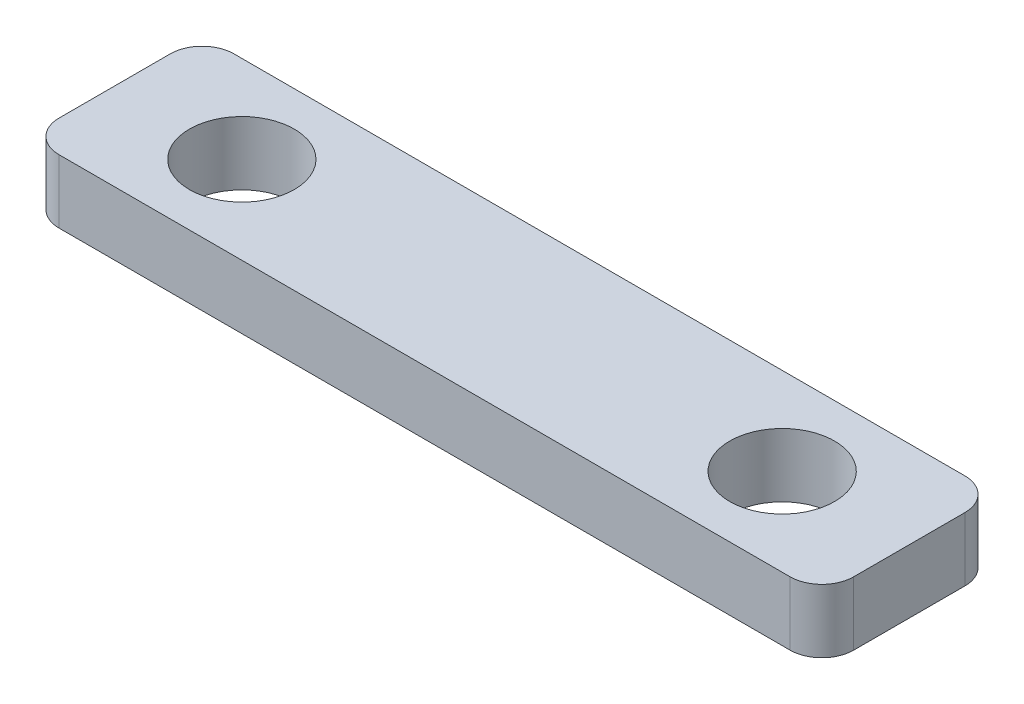
from build123d import *

# Parameters (mm, degrees)
SKETCH1_W           = 25
SKETCH1_H           = 5.5
SKETCH1_R           = 1.65
BOSS_EXTRUDE1_DEPTH = 2
FILLET1_R           = 1


with BuildPart() as part:
    # Sketch1 → Boss-Extrude1 (new body)
    with BuildSketch(Plane(origin=(0, 0, 0), x_dir=(1, 0, 0), z_dir=(0, 1, 0))):
        with Locations((12.5, 2.75)):
            Rectangle(SKETCH1_W, SKETCH1_H)
        with Locations(Location((4, 2.75, 0), (0, 0, 270))):
            Circle(SKETCH1_R, mode=Mode.SUBTRACT)
        with Locations(Location((21, 2.75, 0), (0, 0, 270))):
            Circle(SKETCH1_R, mode=Mode.SUBTRACT)
    extrude(amount=BOSS_EXTRUDE1_DEPTH)

    # Fillet1
    fillet1_edges = [part.edges().sort_by_distance(p)[0] for p in [
        (0, 1, -5.5),
        (25, 1, -5.5),
        (25, 1, 0),
        (0, 1, 0),
    ]]
    fillet(fillet1_edges, radius=FILLET1_R)


solid = part.part
